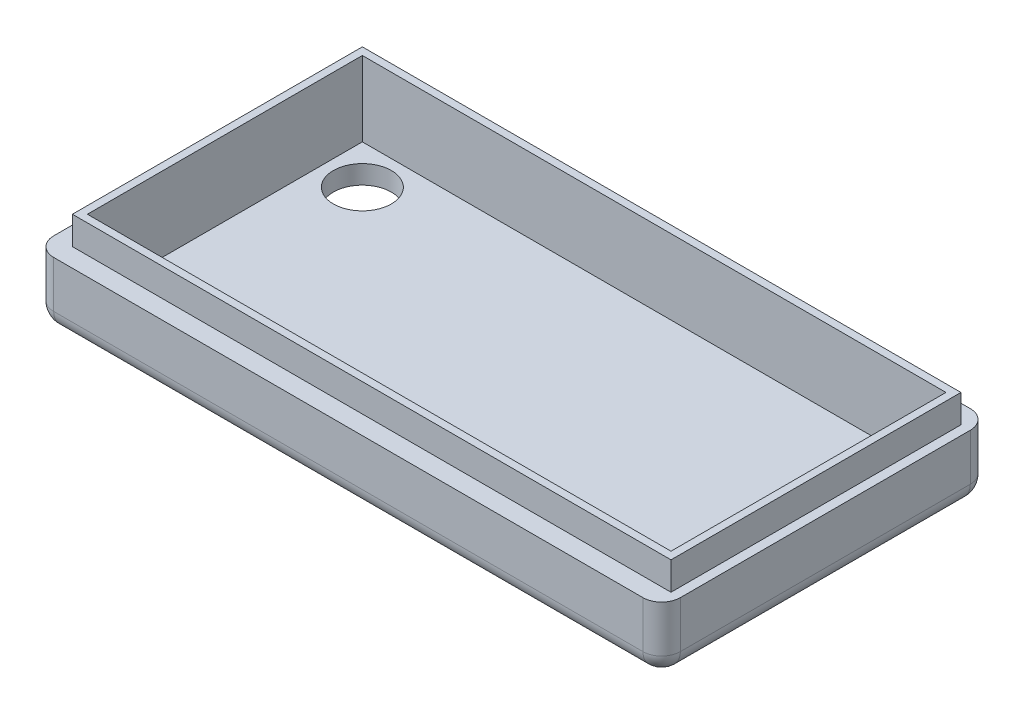
from build123d import *

# Parameters (mm, degrees)
CROQUIS1_W                          = 67
CROQUIS1_H                          = 35
SALIENTE_EXTRUIR1_DEPTH             = 7
CORTAR_EXTRUIR1_DEPTH               = 5
CROQUIS3_R                          = 3.1
CORTAR_EXTRUIR2_DEPTH               = 76.914425507
CROQUIS4_W                          = 64
CROQUIS4_H                          = 31
CROQUIS4_W_2                        = 62.4
CROQUIS4_H_2                        = 29.4
SALIENTE_EXTRUIR2_DEPTH             = 3
SALIENTE_EXTRUIR2_DIRECTION_2_REACH = 77.914
REDONDEO2_R                         = 2
CROQUIS5_W                          = 1.256410257
CROQUIS5_H                          = 7.179487179
CORTAR_EXTRUIR3_DEPTH               = 0.8
CROQUIS6_R                          = 1.75
CORTAR_EXTRUIR5_DEPTH               = 10


with BuildPart() as part:
    # Croquis1 → Saliente-Extruir1 (new body)
    with BuildSketch(Plane(origin=(0, 0, 0), x_dir=(1, 0, 0), z_dir=(0, 1, 0))):
        with Locations((33.5, 17.5)):
            Rectangle(CROQUIS1_W, CROQUIS1_H)
    extrude(amount=SALIENTE_EXTRUIR1_DEPTH)

    # Croquis2 → Cortar-Extruir1 (cut)
    with BuildSketch(Plane(origin=(0, 7, 0), x_dir=(1, 0, 0), z_dir=(0, 1, 0))):
        Polygon((2, 33), (2, 2), (65, 2), (66, 2), (66, 33), (65, 33), align=None)
    extrude(amount=-CORTAR_EXTRUIR1_DEPTH, mode=Mode.SUBTRACT)

    # Croquis3 → Cortar-Extruir2 (cut, through all)
    with BuildSketch(Plane.XZ):
        with Locations((7, -28)):
            Circle(CROQUIS3_R)
    extrude(amount=-CORTAR_EXTRUIR2_DEPTH, mode=Mode.SUBTRACT)

    # Croquis4 → Saliente-Extruir2 (add)
    with BuildSketch(Plane(origin=(0, 7, 0), x_dir=(1, 0, 0), z_dir=(0, 1, 0))):
        with Locations((34, 17.5)):
            Rectangle(CROQUIS4_W, CROQUIS4_H)
        with Locations((34, 17.5)):
            Rectangle(CROQUIS4_W_2, CROQUIS4_H_2, mode=Mode.SUBTRACT)
    extrude(amount=SALIENTE_EXTRUIR2_DEPTH)

    # Croquis4 → Saliente-Extruir2 direction 2 (add, up to next)
    with BuildSketch(Plane(origin=(0, 7, 0), x_dir=(1, 0, 0), z_dir=(0, 1, 0)), mode=Mode.PRIVATE) as saliente_extruir2_direction_2_sk1:
        with Locations((34, 17.5)):
            Rectangle(CROQUIS4_W, CROQUIS4_H)
        with Locations((34, 17.5)):
            Rectangle(CROQUIS4_W_2, CROQUIS4_H_2, mode=Mode.SUBTRACT)
    saliente_extruir2_direction_2_tool1 = extrude(saliente_extruir2_direction_2_sk1.sketch, amount=-SALIENTE_EXTRUIR2_DIRECTION_2_REACH, mode=Mode.PRIVATE) - part.part
    add(saliente_extruir2_direction_2_tool1.solids().sort_by_distance((34, 7, -32.288874))[0])

    # Redondeo2
    redondeo2_edges = [part.edges().sort_by_distance(p)[0] for p in [
        (0, 3.5, 0),
        (0, 3.5, -35),
        (67, 3.5, -35),
        (67, 3.5, 0),
        (33.5, 0, 0),
        (0, 0, -17.5),
        (33.5, 0, -35),
        (67, 0, -17.5),
    ]]
    fillet(redondeo2_edges, radius=REDONDEO2_R)

    # Croquis5 → Cortar-Extruir3 (cut)
    # profile 1 of 7: a face of its own
    with BuildSketch(Plane.XZ):
        with BuildLine():
            Line((11.108974359, -15.615399199), (12.365384615, -15.615399199))
            Line((12.365384615, -15.615399199), (12.365384615, -16.226777404))
            add(Edge.make_bspline(
                [(12.365384615, -16.226777404), (12.421269105, -16.170373894), (12.531301073, -16.059320019), (12.713645567, -15.916550279), (12.903849338, -15.794464512), (13.104217354, -15.695628401), (13.314259524, -15.620159892), (13.532980357, -15.564857681), (13.761503294, -15.532231109), (13.917096528, -15.527871739), (13.99619391, -15.525655609)],
                knots=[0, 0, 0, 0, 1.041528618, 2.050684245, 3.032913108, 4.004406485, 4.976926473, 5.95771665, 6.961784757, 8, 8, 8, 8], degree=3))
            add(Edge.make_bspline(
                [(13.99619391, -15.525655609), (14.075395729, -15.528146859), (14.231301947, -15.533050804), (14.458768035, -15.577926495), (14.67425581, -15.650834329), (14.875394401, -15.754755488), (15.063637519, -15.883092718), (15.230645871, -16.042476324), (15.380973457, -16.226561592), (15.461103848, -16.365732033), (15.502203526, -16.437113942)],
                knots=[0, 0, 0, 0, 1.023965777, 2.015643508, 2.987309376, 3.958410333, 4.93654923, 5.924956801, 6.93568961, 8, 8, 8, 8], degree=3))
            add(Edge.make_bspline(
                [(15.502203526, -16.437113942), (15.555145222, -16.365537846), (15.659054915, -16.225054056), (15.84324431, -16.04163654), (16.042407999, -15.883076099), (16.260399342, -15.753808013), (16.491429243, -15.651189047), (16.734486745, -15.578197387), (16.987368206, -15.533125803), (17.159467918, -15.52816636), (17.246594551, -15.525655609)],
                knots=[0, 0, 0, 0, 1.041189987, 2.043563759, 3.033412161, 4.015238574, 5.00275396, 5.986226558, 6.980513695, 8, 8, 8, 8], degree=3))
            add(Edge.make_bspline(
                [(17.246594551, -15.525655609), (17.336586017, -15.528262637), (17.51183603, -15.533339582), (17.765798465, -15.583287831), (18.003665018, -15.660465371), (18.220178903, -15.772777581), (18.415957641, -15.905815841), (18.582784742, -16.063006097), (18.721235993, -16.238863309), (18.811385512, -16.403071036), (18.869664754, -16.548249471), (18.904854278, -16.674581912), (18.937767371, -16.81564806), (18.961412134, -16.973344043), (18.983483478, -17.146187641), (18.99629676, -17.335327976), (19.005006081, -17.540127879), (19.005931121, -17.681827816), (19.006410256, -17.755222917)],
                knots=[0, 0, 0, 0, 1.321991808, 2.574456155, 3.791773975, 4.987670122, 6.148905103, 7.262530793, 8.344737981, 9.427709016, 10.004683293, 10.642050061, 11.354108788, 12.133887687, 12.985666279, 13.916212488, 14.92067847, 16, 16, 16, 16], degree=3))
            Line((19.006410256, -17.755222917), (19.006410256, -20.730783814))
            Line((19.006410256, -20.730783814), (17.75, -20.730783814))
            Line((17.75, -20.730783814), (17.75, -18.161873558))
            add(Edge.make_bspline(
                [(17.75, -18.161873558), (17.748954276, -18.093159984), (17.746947105, -17.961270487), (17.738413844, -17.772100185), (17.719312755, -17.600539045), (17.696923832, -17.445636779), (17.664884851, -17.308214698), (17.625819131, -17.187941527), (17.580503134, -17.084644139), (17.525785433, -16.998333298), (17.464501543, -16.925645937), (17.396332057, -16.863338473), (17.321987744, -16.810177877), (17.240794566, -16.764866024), (17.150625468, -16.734220721), (17.054524418, -16.710175322), (16.951739395, -16.693800234), (16.880673853, -16.692823999), (16.844150641, -16.692322276)],
                knots=[0, 0, 0, 0, 1.669139205, 3.203761885, 4.596586177, 5.860166715, 7.002923539, 8.018877315, 8.928339525, 9.734594377, 10.491888885, 11.231098709, 11.971440889, 12.708030942, 13.480072485, 14.275788656, 15.113863979, 16, 16, 16, 16], degree=3))
            add(Edge.make_bspline(
                [(16.844150641, -16.692322276), (16.787868889, -16.694268082), (16.677427149, -16.698086339), (16.516491025, -16.734574062), (16.365048947, -16.794227584), (16.223668278, -16.875380917), (16.095391217, -16.976739897), (15.983181261, -17.096961311), (15.890511486, -17.236738007), (15.826363209, -17.366422742), (15.786278593, -17.483683802), (15.75800254, -17.584108483), (15.735962481, -17.697673942), (15.718711567, -17.823230025), (15.70216133, -17.961486513), (15.694041877, -18.112268575), (15.685733198, -18.275366739), (15.68584136, -18.388088553), (15.685897436, -18.446529006)],
                knots=[0, 0, 0, 0, 1.129913425, 2.217230253, 3.297175357, 4.391411011, 5.481605898, 6.571841268, 7.681894157, 8.841607612, 9.468549532, 10.170608623, 10.93710061, 11.791434153, 12.717934886, 13.734733707, 14.825576123, 16, 16, 16, 16], degree=3))
            Line((15.685897436, -18.446529006), (15.685897436, -20.730783814))
            Line((15.685897436, -20.730783814), (14.429487179, -20.730783814))
            Line((14.429487179, -20.730783814), (14.429487179, -18.278259776))
            add(Edge.make_bspline(
                [(14.429487179, -18.278259776), (14.429381691, -18.22356526), (14.429178765, -18.11835073), (14.42307922, -17.966418934), (14.41500223, -17.826130756), (14.403679231, -17.697094907), (14.390620381, -17.579471876), (14.371773452, -17.473905143), (14.351973013, -17.379813003), (14.318024894, -17.27292714), (14.270187629, -17.154479715), (14.198718055, -17.028872817), (14.112301579, -16.923706641), (14.013122372, -16.838162772), (13.901045613, -16.772985207), (13.778910554, -16.7245012), (13.644385103, -16.698331021), (13.551786776, -16.694367458), (13.50400641, -16.692322276)],
                knots=[0, 0, 0, 0, 1.256487322, 2.417074606, 3.49288742, 4.484586665, 5.393016842, 6.210437544, 6.947749329, 7.599905853, 8.784490193, 9.876739139, 10.906602197, 11.896672079, 12.869113195, 13.872201355, 14.902064413, 16, 16, 16, 16], degree=3))
            add(Edge.make_bspline(
                [(13.50400641, -16.692322276), (13.450018708, -16.694154712), (13.343095613, -16.697783867), (13.18734579, -16.736763961), (13.038434515, -16.795322952), (12.899637684, -16.878739774), (12.773293125, -16.98248404), (12.66220663, -17.106125051), (12.57002387, -17.24951615), (12.50559085, -17.382778055), (12.466090716, -17.502964616), (12.437054361, -17.605996918), (12.415834332, -17.722063345), (12.398129495, -17.849860676), (12.381677242, -17.989539762), (12.373524192, -18.141714857), (12.365223724, -18.306217288), (12.365329692, -18.419873007), (12.365384615, -18.478780609)],
                knots=[0, 0, 0, 0, 1.07893236, 2.136834559, 3.195274846, 4.273923004, 5.364443877, 6.458052972, 7.587287137, 8.767908, 9.410170275, 10.118584836, 10.909717261, 11.770069756, 12.702352573, 13.724628867, 14.820678298, 16, 16, 16, 16], degree=3))
            Line((12.365384615, -18.478780609), (12.365384615, -20.730783814))
            Line((12.365384615, -20.730783814), (11.108974359, -20.730783814))
            Line((11.108974359, -20.730783814), (11.108974359, -15.615399199))
        make_face()
    # profile 2 of 7: a face of its own
    with BuildSketch(Plane.XZ):
        with BuildLine():
            Line((26.724358974, -14.945126763), (25.803084936, -15.825735737))
            add(Edge.make_bspline(
                [(25.803084936, -15.825735737), (25.724934967, -15.744928538), (25.572283593, -15.587086762), (25.326304783, -15.37811816), (25.070495777, -15.203971105), (24.809832828, -15.057305564), (24.539627366, -14.946342629), (24.263003701, -14.865482069), (23.978195511, -14.816184443), (23.785448282, -14.810543922), (23.688501603, -14.807706891)],
                knots=[0, 0, 0, 0, 1.115251505, 2.178435587, 3.19620269, 4.182487026, 5.141301733, 6.088180966, 7.038406374, 8, 8, 8, 8], degree=3))
            add(Edge.make_bspline(
                [(23.688501603, -14.807706891), (23.607539344, -14.809948244), (23.447769247, -14.814371308), (23.213184877, -14.846796728), (22.988792804, -14.901937567), (22.773824898, -14.977931856), (22.56891371, -15.076264434), (22.37362962, -15.196859192), (22.188454093, -15.338626988), (22.015833189, -15.50083431), (21.857925653, -15.678057999), (21.71840429, -15.867155252), (21.601532768, -16.067692859), (21.505618211, -16.277639921), (21.430904478, -16.497968178), (21.377549487, -16.728529295), (21.346690385, -16.969597854), (21.342084458, -17.133474464), (21.33974359, -17.216761378)],
                knots=[0, 0, 0, 0, 1.035432265, 2.043311493, 3.022114605, 3.98653278, 4.95457646, 5.923598177, 6.917315552, 7.932509744, 8.948865224, 9.949768934, 10.933144597, 11.912367597, 12.897413939, 13.903909035, 14.934704909, 16, 16, 16, 16], degree=3))
            add(Edge.make_bspline(
                [(21.33974359, -17.216761378), (21.340418201, -17.275217962), (21.341747874, -17.39043709), (21.356303497, -17.560878157), (21.379741482, -17.726246287), (21.413662052, -17.88629099), (21.456080059, -18.041150963), (21.50584604, -18.192162175), (21.568276731, -18.33723799), (21.63757574, -18.478063371), (21.718169689, -18.610795721), (21.805064833, -18.737367031), (21.89928843, -18.857156864), (22.001450771, -18.969675514), (22.112989665, -19.073164566), (22.231022243, -19.17073606), (22.357539552, -19.25994745), (22.489913507, -19.343037595), (22.629287651, -19.415218711), (22.77188044, -19.480600857), (22.91985387, -19.53370088), (23.071406274, -19.576504344), (23.225996057, -19.612902296), (23.385135251, -19.635313635), (23.547444319, -19.652285479), (23.657138006, -19.653333391), (23.712339744, -19.653860737)],
                knots=[0, 0, 0, 0, 1.103660481, 2.175337485, 3.227646561, 4.255952547, 5.262355991, 6.258840057, 7.255597736, 8.242457506, 9.22035537, 10.185017736, 11.140346927, 12.096287581, 13.051739095, 14.01125915, 14.986044842, 15.97314143, 16.960198552, 17.947847494, 18.933482797, 19.925264591, 20.920966487, 21.929612487, 22.958107872, 24, 24, 24, 24], degree=3))
            add(Edge.make_bspline(
                [(23.712339744, -19.653860737), (23.805971377, -19.651152413), (23.98993319, -19.645831262), (24.259923602, -19.604220608), (24.517197566, -19.535773436), (24.722758232, -19.454941304), (24.883809585, -19.375118525), (25.006415599, -19.301286384), (25.133199773, -19.218697029), (25.262056331, -19.124233447), (25.394434653, -19.019029239), (25.527997957, -18.900780237), (25.666165487, -18.773380211), (25.756677666, -18.68245231), (25.803084936, -18.635831891)],
                knots=[0, 0, 0, 0, 1.404581149, 2.759636711, 4.088442092, 5.392261763, 6.066678138, 6.783632037, 7.538459478, 8.336747902, 9.180226004, 10.074962426, 11.012997595, 12, 12, 12, 12], degree=3))
            Line((25.803084936, -18.635831891), (26.696314103, -19.573932853))
            add(Edge.make_bspline(
                [(26.696314103, -19.573932853), (26.6335249, -19.634553856), (26.510973805, -19.752873092), (26.326108879, -19.920875365), (26.141476614, -20.071844083), (25.961537339, -20.21125875), (25.783343462, -20.335057877), (25.60691388, -20.443365104), (25.434245852, -20.538919678), (25.261753873, -20.620110117), (25.088364607, -20.689049232), (24.909967429, -20.748401285), (24.726016961, -20.798610986), (24.535389719, -20.839123622), (24.339863755, -20.871609286), (24.137609208, -20.893536921), (23.929908471, -20.908278141), (23.789021844, -20.909602762), (23.717948718, -20.910270994)],
                knots=[0, 0, 0, 0, 1.244526981, 2.429050516, 3.560637417, 4.644440555, 5.67424972, 6.652764056, 7.595344123, 8.486817594, 9.369275933, 10.254498637, 11.166417451, 12.086725134, 13.032340136, 13.991389299, 14.986715468, 16, 16, 16, 16], degree=3))
            add(Edge.make_bspline(
                [(23.717948718, -20.910270994), (23.58739619, -20.906942949), (23.331941182, -20.900430892), (22.957578529, -20.852180954), (22.601944057, -20.771290783), (22.264172576, -20.656889771), (21.944371487, -20.510747839), (21.642622607, -20.331584692), (21.359412286, -20.11987634), (21.097028308, -19.878104208), (20.859689513, -19.611087186), (20.649909502, -19.324384157), (20.47637947, -19.016586082), (20.332293745, -18.692240122), (20.219620603, -18.349866159), (20.140317813, -17.989093849), (20.09141236, -17.610271541), (20.086062034, -17.351527172), (20.083333333, -17.219565865)],
                knots=[0, 0, 0, 0, 1.078019885, 2.10938526, 3.111377082, 4.085535484, 5.04941344, 6.010039228, 6.978205633, 7.964457913, 8.951525778, 9.924444315, 10.892603023, 11.863865945, 12.85144698, 13.863884204, 14.910567087, 16, 16, 16, 16], degree=3))
            add(Edge.make_bspline(
                [(20.083333333, -17.219565865), (20.08448635, -17.133501827), (20.086771348, -16.962943938), (20.110786882, -16.711698349), (20.144265934, -16.46677884), (20.197377406, -16.230728489), (20.261398046, -16.00036726), (20.341016124, -15.778198912), (20.436104478, -15.563584911), (20.543598187, -15.35616598), (20.665204745, -15.157300934), (20.801052619, -14.968698339), (20.947644557, -14.788902217), (21.108502923, -14.620297897), (21.281290235, -14.461405), (21.466786608, -14.313084598), (21.663876373, -14.173209608), (21.873092979, -14.045387068), (22.090371906, -13.929764786), (22.312972693, -13.827780995), (22.540348438, -13.742546031), (22.771537774, -13.671846773), (23.007517473, -13.619074776), (23.246603173, -13.579128076), (23.490829206, -13.556797616), (23.654805829, -13.553141977), (23.737580128, -13.551296635)],
                knots=[0, 0, 0, 0, 1.071919942, 2.124283339, 3.142214191, 4.149696895, 5.136002878, 6.119640489, 7.086990633, 8.058538607, 9.028339693, 9.988281803, 10.952401235, 11.916291999, 12.888973767, 13.874849856, 14.873389453, 15.898127285, 16.927174885, 17.938320013, 18.946391617, 19.950418109, 20.947802303, 21.956882652, 22.968648068, 24, 24, 24, 24], degree=3))
            add(Edge.make_bspline(
                [(23.737580128, -13.551296635), (23.808195093, -13.552354431), (23.948690823, -13.554459025), (24.157912541, -13.572003106), (24.365461001, -13.599555907), (24.570593117, -13.641127218), (24.774776203, -13.690477616), (24.975327065, -13.755095156), (25.1754095, -13.827123581), (25.371885514, -13.913218855), (25.565029357, -14.007199625), (25.750316331, -14.113824221), (25.930857387, -14.226531084), (26.102651844, -14.351990702), (26.268917781, -14.48565242), (26.42878578, -14.628139845), (26.580852906, -14.781828661), (26.676281791, -14.890418883), (26.724358974, -14.945126763)],
                knots=[0, 0, 0, 0, 0.996412454, 1.982464992, 2.961075852, 3.949442424, 4.934965278, 5.923860011, 6.921385422, 7.934793307, 8.949617135, 9.951082467, 10.950285876, 11.951772932, 12.951063433, 13.960125323, 14.972308753, 16, 16, 16, 16], degree=3))
        make_face()
    # profile 3 of 7: a face of its own
    with BuildSketch(Plane.XZ):
        with BuildLine():
            Line((31.66025641, -15.615399199), (32.916666667, -15.615399199))
            Line((32.916666667, -15.615399199), (32.916666667, -20.730783814))
            Line((32.916666667, -20.730783814), (31.66025641, -20.730783814))
            Line((31.66025641, -20.730783814), (31.66025641, -20.172690865))
            add(Edge.make_bspline(
                [(31.66025641, -20.172690865), (31.598001745, -20.227015037), (31.477177734, -20.332447527), (31.286798188, -20.469248862), (31.095862332, -20.582092284), (30.903452712, -20.671965915), (30.706612075, -20.738328342), (30.503923245, -20.786376289), (30.292467289, -20.814711338), (30.148722443, -20.818568521), (30.075721154, -20.820527404)],
                knots=[0, 0, 0, 0, 1.129196829, 2.191548051, 3.199897424, 4.157751732, 5.089409408, 6.034969131, 7.002052659, 8, 8, 8, 8], degree=3))
            add(Edge.make_bspline(
                [(30.075721154, -20.820527404), (29.993773962, -20.818683848), (29.831841665, -20.815040878), (29.594223998, -20.776692739), (29.364780517, -20.717992365), (29.143697467, -20.634923999), (28.931377087, -20.527283681), (28.726194484, -20.397879899), (28.531667113, -20.242169804), (28.346175599, -20.066890577), (28.176340681, -19.87408218), (28.027869393, -19.666420767), (27.902719132, -19.446851557), (27.800190219, -19.216102524), (27.719537989, -18.974343022), (27.66204449, -18.720806266), (27.628123259, -18.455401705), (27.623924767, -18.274618512), (27.621794872, -18.182907212)],
                knots=[0, 0, 0, 0, 0.980476535, 1.937477201, 2.874147792, 3.812856188, 4.758993464, 5.720109578, 6.712210464, 7.737600662, 8.772720504, 9.783789959, 10.789002326, 11.793715968, 12.802552247, 13.835794126, 14.902098527, 16, 16, 16, 16], degree=3))
            add(Edge.make_bspline(
                [(27.621794872, -18.182907212), (27.624030205, -18.08794004), (27.628415059, -17.901651351), (27.660490005, -17.628281557), (27.716922533, -17.368458378), (27.793872341, -17.121821921), (27.892854907, -16.888329577), (28.01340906, -16.66759881), (28.157174824, -16.460206575), (28.322839382, -16.269682834), (28.501716414, -16.095058623), (28.693083217, -15.9430344), (28.893947231, -15.813882748), (29.104521909, -15.70844488), (29.324777181, -15.626967832), (29.553843482, -15.567401457), (29.792737705, -15.53165954), (29.955474385, -15.52767354), (30.037860577, -15.525655609)],
                knots=[0, 0, 0, 0, 1.136281865, 2.228943489, 3.287578264, 4.313574083, 5.316051562, 6.317280042, 7.318008486, 8.329309503, 9.333984563, 10.305318864, 11.248632312, 12.186624717, 13.117503092, 14.05354244, 15.014596925, 16, 16, 16, 16], degree=3))
            add(Edge.make_bspline(
                [(30.037860577, -15.525655609), (30.114176885, -15.527241096), (30.265179351, -15.530378204), (30.487131219, -15.564441191), (30.702392519, -15.615959041), (30.909788989, -15.689362703), (31.111021765, -15.78204976), (31.302629516, -15.898193551), (31.488803835, -16.032912605), (31.602399441, -16.138131039), (31.66025641, -16.191721314)],
                knots=[0, 0, 0, 0, 1.017011718, 2.012299608, 2.98747302, 3.965332399, 4.941441765, 5.936729654, 6.94912688, 8, 8, 8, 8], degree=3))
            Line((31.66025641, -16.191721314), (31.66025641, -15.615399199))
        make_face()
        with BuildLine():
            add(Edge.make_bspline(
                [(30.301482372, -16.692322276), (30.251418127, -16.693858419), (30.153295475, -16.696869161), (30.008992688, -16.714978982), (29.871082513, -16.746889294), (29.740548514, -16.794029927), (29.615445255, -16.851454086), (29.497672448, -16.923376901), (29.386258079, -17.008388139), (29.281857388, -17.10442968), (29.186680776, -17.209996894), (29.104632981, -17.325193597), (29.034905611, -17.446915892), (28.975934378, -17.575529757), (28.933724354, -17.712557091), (28.900294033, -17.856214042), (28.882945861, -18.007674213), (28.879801184, -18.110889633), (28.878205128, -18.163275801)],
                knots=[0, 0, 0, 0, 1.04836806, 2.054732945, 3.03993516, 4.00574415, 4.955904794, 5.917688631, 6.888591924, 7.88601754, 8.884115178, 9.859153345, 10.841239365, 11.818093293, 12.814750328, 13.83810466, 14.90274714, 16, 16, 16, 16], degree=3))
            add(Edge.make_bspline(
                [(28.878205128, -18.163275801), (28.879776804, -18.216137143), (28.882873772, -18.320299803), (28.900574536, -18.473037596), (28.932801896, -18.618793037), (28.9798204, -18.756387794), (29.037240899, -18.887678475), (29.107134559, -19.012059161), (29.192986679, -19.127330646), (29.288246724, -19.236220639), (29.394789179, -19.333455178), (29.506833975, -19.419790521), (29.625911556, -19.492027248), (29.750730014, -19.550409427), (29.880869204, -19.597985995), (30.017960678, -19.62949526), (30.160661452, -19.649638536), (30.257944337, -19.652443618), (30.307091346, -19.653860737)],
                knots=[0, 0, 0, 0, 1.099136573, 2.165835871, 3.191374663, 4.196217796, 5.183857741, 6.167377911, 7.154730987, 8.166690795, 9.170734848, 10.148332609, 11.103258353, 12.059567475, 13.009337315, 13.978056681, 14.978520572, 16, 16, 16, 16], degree=3))
            add(Edge.make_bspline(
                [(30.307091346, -19.653860737), (30.358088096, -19.652315981), (30.458069449, -19.64928742), (30.604726463, -19.631342871), (30.744489267, -19.599315557), (30.876776372, -19.551905033), (31.003608338, -19.494893066), (31.123840621, -19.424375678), (31.236168519, -19.339559517), (31.34116092, -19.242649758), (31.437366217, -19.136220524), (31.520548668, -19.0195132), (31.593003626, -18.896260405), (31.649986117, -18.763547994), (31.695238205, -18.623697814), (31.727705535, -18.475841927), (31.74536588, -18.319820925), (31.748435763, -18.213330511), (31.75, -18.159069071)],
                knots=[0, 0, 0, 0, 1.050008698, 2.058587853, 3.036635738, 3.995319155, 4.947022481, 5.895997462, 6.858296291, 7.838991643, 8.833936038, 9.806048392, 10.784806122, 11.771666913, 12.772873988, 13.80724452, 14.882696879, 16, 16, 16, 16], degree=3))
            add(Edge.make_bspline(
                [(31.75, -18.159069071), (31.7484552, -18.105740901), (31.745437757, -18.001575494), (31.727629371, -17.848812137), (31.694931541, -17.703859464), (31.650610815, -17.566451034), (31.592614589, -17.436901028), (31.520104809, -17.316645849), (31.437834822, -17.201519104), (31.340564394, -17.097965114), (31.23614076, -17.001757055), (31.122160898, -16.919505797), (31.002215794, -16.84861938), (30.875568502, -16.790418898), (30.741046325, -16.747755738), (30.601044676, -16.714723214), (30.453379239, -16.69688003), (30.352940922, -16.69386632), (30.301482372, -16.692322276)],
                knots=[0, 0, 0, 0, 1.106611376, 2.161533483, 3.185006901, 4.184773755, 5.152708835, 6.122342771, 7.094156588, 8.082475533, 9.064254463, 10.03606828, 10.992420271, 11.951521816, 12.920622147, 13.915721683, 14.932141191, 16, 16, 16, 16], degree=3))
        make_face(mode=Mode.SUBTRACT)
    # profile 4 of 7: a face of its own
    with BuildSketch(Plane.XZ):
        with Locations((34.711538461, -17.141040225)):
            Rectangle(CROQUIS5_W, CROQUIS5_H)
    # profile 5 of 7: a face of its own
    with BuildSketch(Plane.XZ):
        with BuildLine():
            Line((42.967948718, -14.945126763), (42.046674679, -15.825735737))
            add(Edge.make_bspline(
                [(42.046674679, -15.825735737), (41.96852471, -15.744928538), (41.815873336, -15.587086762), (41.569894526, -15.37811816), (41.31408552, -15.203971105), (41.053422572, -15.057305564), (40.783217109, -14.946342629), (40.506593445, -14.865482069), (40.221785254, -14.816184443), (40.029038025, -14.810543922), (39.932091346, -14.807706891)],
                knots=[0, 0, 0, 0, 1.115251505, 2.178435587, 3.19620269, 4.182487026, 5.141301733, 6.088180966, 7.038406374, 8, 8, 8, 8], degree=3))
            add(Edge.make_bspline(
                [(39.932091346, -14.807706891), (39.851129088, -14.809948244), (39.691358991, -14.814371308), (39.456774621, -14.846796728), (39.232382548, -14.901937567), (39.017414641, -14.977931856), (38.812503454, -15.076264434), (38.617219364, -15.196859192), (38.432043836, -15.338626988), (38.259422932, -15.50083431), (38.101515396, -15.678057999), (37.961994033, -15.867155252), (37.845122511, -16.067692859), (37.749207954, -16.277639921), (37.674494222, -16.497968178), (37.62113923, -16.728529295), (37.590280129, -16.969597854), (37.585674201, -17.133474464), (37.583333333, -17.216761378)],
                knots=[0, 0, 0, 0, 1.035432265, 2.043311493, 3.022114605, 3.98653278, 4.95457646, 5.923598177, 6.917315552, 7.932509744, 8.948865224, 9.949768934, 10.933144597, 11.912367597, 12.897413939, 13.903909035, 14.934704909, 16, 16, 16, 16], degree=3))
            add(Edge.make_bspline(
                [(37.583333333, -17.216761378), (37.584007945, -17.275217962), (37.585337618, -17.39043709), (37.59989324, -17.560878157), (37.623331225, -17.726246287), (37.657251796, -17.88629099), (37.699669803, -18.041150963), (37.749435784, -18.192162175), (37.811866475, -18.33723799), (37.881165484, -18.478063371), (37.961759432, -18.610795721), (38.048654577, -18.737367031), (38.142878174, -18.857156864), (38.245040515, -18.969675514), (38.356579409, -19.073164566), (38.474611987, -19.17073606), (38.601129296, -19.25994745), (38.73350325, -19.343037595), (38.872877394, -19.415218711), (39.015470184, -19.480600857), (39.163443613, -19.53370088), (39.314996017, -19.576504344), (39.4695858, -19.612902296), (39.628724995, -19.635313635), (39.791034063, -19.652285479), (39.900727749, -19.653333391), (39.955929487, -19.653860737)],
                knots=[0, 0, 0, 0, 1.103660481, 2.175337485, 3.227646561, 4.255952547, 5.262355991, 6.258840057, 7.255597736, 8.242457506, 9.22035537, 10.185017736, 11.140346927, 12.096287581, 13.051739095, 14.01125915, 14.986044842, 15.97314143, 16.960198552, 17.947847494, 18.933482797, 19.925264591, 20.920966487, 21.929612487, 22.958107872, 24, 24, 24, 24], degree=3))
            add(Edge.make_bspline(
                [(39.955929487, -19.653860737), (40.049561121, -19.651152413), (40.233522934, -19.645831262), (40.503513345, -19.604220608), (40.76078731, -19.535773436), (40.966347976, -19.454941304), (41.127399329, -19.375118525), (41.250005342, -19.301286384), (41.376789517, -19.218697029), (41.505646075, -19.124233447), (41.638024397, -19.019029239), (41.7715877, -18.900780237), (41.90975523, -18.773380211), (42.000267409, -18.68245231), (42.046674679, -18.635831891)],
                knots=[0, 0, 0, 0, 1.404581149, 2.759636711, 4.088442092, 5.392261763, 6.066678138, 6.783632037, 7.538459478, 8.336747902, 9.180226004, 10.074962426, 11.012997595, 12, 12, 12, 12], degree=3))
            Line((42.046674679, -18.635831891), (42.939903846, -19.573932853))
            add(Edge.make_bspline(
                [(42.939903846, -19.573932853), (42.877114644, -19.634553856), (42.754563548, -19.752873092), (42.569698623, -19.920875365), (42.385066357, -20.071844083), (42.205127082, -20.21125875), (42.026933205, -20.335057877), (41.850503623, -20.443365104), (41.677835596, -20.538919678), (41.505343617, -20.620110117), (41.331954351, -20.689049232), (41.153557173, -20.748401285), (40.969606705, -20.798610986), (40.778979462, -20.839123622), (40.583453499, -20.871609286), (40.381198952, -20.893536921), (40.173498215, -20.908278141), (40.032611587, -20.909602762), (39.961538462, -20.910270994)],
                knots=[0, 0, 0, 0, 1.244526981, 2.429050516, 3.560637417, 4.644440555, 5.67424972, 6.652764056, 7.595344123, 8.486817594, 9.369275933, 10.254498637, 11.166417451, 12.086725134, 13.032340136, 13.991389299, 14.986715468, 16, 16, 16, 16], degree=3))
            add(Edge.make_bspline(
                [(39.961538462, -20.910270994), (39.830985934, -20.906942949), (39.575530926, -20.900430892), (39.201168273, -20.852180954), (38.845533801, -20.771290783), (38.507762319, -20.656889771), (38.187961231, -20.510747839), (37.88621235, -20.331584692), (37.60300203, -20.11987634), (37.340618052, -19.878104208), (37.103279256, -19.611087186), (36.893499246, -19.324384157), (36.719969214, -19.016586082), (36.575883489, -18.692240122), (36.463210347, -18.349866159), (36.383907556, -17.989093849), (36.335002104, -17.610271541), (36.329651778, -17.351527172), (36.326923077, -17.219565865)],
                knots=[0, 0, 0, 0, 1.078019885, 2.10938526, 3.111377082, 4.085535484, 5.04941344, 6.010039228, 6.978205633, 7.964457913, 8.951525778, 9.924444315, 10.892603023, 11.863865945, 12.85144698, 13.863884204, 14.910567087, 16, 16, 16, 16], degree=3))
            add(Edge.make_bspline(
                [(36.326923077, -17.219565865), (36.328076094, -17.133501827), (36.330361091, -16.962943938), (36.354376626, -16.711698349), (36.387855678, -16.46677884), (36.440967149, -16.230728489), (36.50498779, -16.00036726), (36.584605868, -15.778198912), (36.679694222, -15.563584911), (36.787187931, -15.35616598), (36.908794488, -15.157300934), (37.044642363, -14.968698339), (37.1912343, -14.788902217), (37.352092667, -14.620297897), (37.524879979, -14.461405), (37.710376351, -14.313084598), (37.907466116, -14.173209608), (38.116682723, -14.045387068), (38.333961649, -13.929764786), (38.556562437, -13.827780995), (38.783938182, -13.742546031), (39.015127517, -13.671846773), (39.251107217, -13.619074776), (39.490192917, -13.579128076), (39.73441895, -13.556797616), (39.898395573, -13.553141977), (39.981169872, -13.551296635)],
                knots=[0, 0, 0, 0, 1.071919942, 2.124283339, 3.142214191, 4.149696895, 5.136002878, 6.119640489, 7.086990633, 8.058538607, 9.028339693, 9.988281803, 10.952401235, 11.916291999, 12.888973767, 13.874849856, 14.873389453, 15.898127285, 16.927174885, 17.938320013, 18.946391617, 19.950418109, 20.947802303, 21.956882652, 22.968648068, 24, 24, 24, 24], degree=3))
            add(Edge.make_bspline(
                [(39.981169872, -13.551296635), (40.051784836, -13.552354431), (40.192280566, -13.554459025), (40.401502284, -13.572003106), (40.609050745, -13.599555907), (40.814182861, -13.641127218), (41.018365947, -13.690477616), (41.218916809, -13.755095156), (41.418999244, -13.827123581), (41.615475257, -13.913218855), (41.808619101, -14.007199625), (41.993906075, -14.113824221), (42.174447131, -14.226531084), (42.346241587, -14.351990702), (42.512507525, -14.48565242), (42.672375524, -14.628139845), (42.82444265, -14.781828661), (42.919871534, -14.890418883), (42.967948718, -14.945126763)],
                knots=[0, 0, 0, 0, 0.996412454, 1.982464992, 2.961075852, 3.949442424, 4.934965278, 5.923860011, 6.921385422, 7.934793307, 8.949617135, 9.951082467, 10.950285876, 11.951772932, 12.951063433, 13.960125323, 14.972308753, 16, 16, 16, 16], degree=3))
        make_face()
    # profile 6 of 7: a face of its own
    with BuildSketch(Plane.XZ):
        with BuildLine():
            Line((47.903846154, -15.615399199), (49.16025641, -15.615399199))
            Line((49.16025641, -15.615399199), (49.16025641, -20.730783814))
            Line((49.16025641, -20.730783814), (47.903846154, -20.730783814))
            Line((47.903846154, -20.730783814), (47.903846154, -20.172690865))
            add(Edge.make_bspline(
                [(47.903846154, -20.172690865), (47.841591489, -20.227015037), (47.720767477, -20.332447527), (47.530387932, -20.469248862), (47.339452076, -20.582092284), (47.147042456, -20.671965915), (46.950201818, -20.738328342), (46.747512989, -20.786376289), (46.536057032, -20.814711338), (46.392312187, -20.818568521), (46.319310897, -20.820527404)],
                knots=[0, 0, 0, 0, 1.129196829, 2.191548051, 3.199897424, 4.157751732, 5.089409408, 6.034969131, 7.002052659, 8, 8, 8, 8], degree=3))
            add(Edge.make_bspline(
                [(46.319310897, -20.820527404), (46.237363705, -20.818683848), (46.075431409, -20.815040878), (45.837813742, -20.776692739), (45.60837026, -20.717992365), (45.38728721, -20.634923999), (45.174966831, -20.527283681), (44.969784228, -20.397879899), (44.775256856, -20.242169804), (44.589765342, -20.066890577), (44.419930425, -19.87408218), (44.271459137, -19.666420767), (44.146308875, -19.446851557), (44.043779963, -19.216102524), (43.963127733, -18.974343022), (43.905634234, -18.720806266), (43.871713003, -18.455401705), (43.86751451, -18.274618512), (43.865384615, -18.182907212)],
                knots=[0, 0, 0, 0, 0.980476535, 1.937477201, 2.874147792, 3.812856188, 4.758993464, 5.720109578, 6.712210464, 7.737600662, 8.772720504, 9.783789959, 10.789002326, 11.793715968, 12.802552247, 13.835794126, 14.902098527, 16, 16, 16, 16], degree=3))
            add(Edge.make_bspline(
                [(43.865384615, -18.182907212), (43.867619948, -18.08794004), (43.872004802, -17.901651351), (43.904079749, -17.628281557), (43.960512276, -17.368458378), (44.037462085, -17.121821921), (44.136444651, -16.888329577), (44.256998803, -16.66759881), (44.400764568, -16.460206575), (44.566429125, -16.269682834), (44.745306158, -16.095058623), (44.936672961, -15.9430344), (45.137536974, -15.813882748), (45.348111653, -15.70844488), (45.568366925, -15.626967832), (45.797433226, -15.567401457), (46.036327448, -15.53165954), (46.199064129, -15.52767354), (46.281450321, -15.525655609)],
                knots=[0, 0, 0, 0, 1.136281865, 2.228943489, 3.287578264, 4.313574083, 5.316051562, 6.317280042, 7.318008486, 8.329309503, 9.333984563, 10.305318864, 11.248632312, 12.186624717, 13.117503092, 14.05354244, 15.014596925, 16, 16, 16, 16], degree=3))
            add(Edge.make_bspline(
                [(46.281450321, -15.525655609), (46.357766629, -15.527241096), (46.508769094, -15.530378204), (46.730720962, -15.564441191), (46.945982262, -15.615959041), (47.153378733, -15.689362703), (47.354611509, -15.78204976), (47.54621926, -15.898193551), (47.732393578, -16.032912605), (47.845989184, -16.138131039), (47.903846154, -16.191721314)],
                knots=[0, 0, 0, 0, 1.017011718, 2.012299608, 2.98747302, 3.965332399, 4.941441765, 5.936729654, 6.94912688, 8, 8, 8, 8], degree=3))
            Line((47.903846154, -16.191721314), (47.903846154, -15.615399199))
        make_face()
        with BuildLine():
            add(Edge.make_bspline(
                [(46.545072115, -16.692322276), (46.49500787, -16.693858419), (46.396885219, -16.696869161), (46.252582432, -16.714978982), (46.114672256, -16.746889294), (45.984138257, -16.794029927), (45.859034998, -16.851454086), (45.741262191, -16.923376901), (45.629847823, -17.008388139), (45.525447132, -17.10442968), (45.43027052, -17.209996894), (45.348222725, -17.325193597), (45.278495355, -17.446915892), (45.219524121, -17.575529757), (45.177314098, -17.712557091), (45.143883777, -17.856214042), (45.126535604, -18.007674213), (45.123390928, -18.110889633), (45.121794872, -18.163275801)],
                knots=[0, 0, 0, 0, 1.04836806, 2.054732945, 3.03993516, 4.00574415, 4.955904794, 5.917688631, 6.888591924, 7.88601754, 8.884115178, 9.859153345, 10.841239365, 11.818093293, 12.814750328, 13.83810466, 14.90274714, 16, 16, 16, 16], degree=3))
            add(Edge.make_bspline(
                [(45.121794872, -18.163275801), (45.123366547, -18.216137143), (45.126463516, -18.320299803), (45.14416428, -18.473037596), (45.17639164, -18.618793037), (45.223410143, -18.756387794), (45.280830642, -18.887678475), (45.350724303, -19.012059161), (45.436576423, -19.127330646), (45.531836468, -19.236220639), (45.638378922, -19.333455178), (45.750423718, -19.419790521), (45.869501299, -19.492027248), (45.994319757, -19.550409427), (46.124458948, -19.597985995), (46.261550422, -19.62949526), (46.404251195, -19.649638536), (46.501534081, -19.652443618), (46.55068109, -19.653860737)],
                knots=[0, 0, 0, 0, 1.099136573, 2.165835871, 3.191374663, 4.196217796, 5.183857741, 6.167377911, 7.154730987, 8.166690795, 9.170734848, 10.148332609, 11.103258353, 12.059567475, 13.009337315, 13.978056681, 14.978520572, 16, 16, 16, 16], degree=3))
            add(Edge.make_bspline(
                [(46.55068109, -19.653860737), (46.60167784, -19.652315981), (46.701659193, -19.64928742), (46.848316207, -19.631342871), (46.988079011, -19.599315557), (47.120366116, -19.551905033), (47.247198082, -19.494893066), (47.367430365, -19.424375678), (47.479758262, -19.339559517), (47.584750664, -19.242649758), (47.680955961, -19.136220524), (47.764138412, -19.0195132), (47.836593369, -18.896260405), (47.89357586, -18.763547994), (47.938827949, -18.623697814), (47.971295279, -18.475841927), (47.988955624, -18.319820925), (47.992025506, -18.213330511), (47.993589744, -18.159069071)],
                knots=[0, 0, 0, 0, 1.050008698, 2.058587853, 3.036635738, 3.995319155, 4.947022481, 5.895997462, 6.858296291, 7.838991643, 8.833936038, 9.806048392, 10.784806122, 11.771666913, 12.772873988, 13.80724452, 14.882696879, 16, 16, 16, 16], degree=3))
            add(Edge.make_bspline(
                [(47.993589744, -18.159069071), (47.992044944, -18.105740901), (47.9890275, -18.001575494), (47.971219114, -17.848812137), (47.938521285, -17.703859464), (47.894200559, -17.566451034), (47.836204332, -17.436901028), (47.763694553, -17.316645849), (47.681424566, -17.201519104), (47.584154137, -17.097965114), (47.479730503, -17.001757055), (47.365750642, -16.919505797), (47.245805537, -16.84861938), (47.119158245, -16.790418898), (46.984636069, -16.747755738), (46.84463442, -16.714723214), (46.696968982, -16.69688003), (46.596530666, -16.69386632), (46.545072115, -16.692322276)],
                knots=[0, 0, 0, 0, 1.106611376, 2.161533483, 3.185006901, 4.184773755, 5.152708835, 6.122342771, 7.094156588, 8.082475533, 9.064254463, 10.03606828, 10.992420271, 11.951521816, 12.920622147, 13.915721683, 14.932141191, 16, 16, 16, 16], degree=3))
        make_face(mode=Mode.SUBTRACT)
    # profile 7 of 7: a face of its own
    with BuildSketch(Plane.XZ):
        with BuildLine():
            Line((50.416666667, -15.615399199), (51.673076923, -15.615399199))
            Line((51.673076923, -15.615399199), (51.673076923, -16.156665224))
            add(Edge.make_bspline(
                [(51.673076923, -16.156665224), (51.744754505, -16.100912925), (51.881744299, -15.994359442), (52.089992438, -15.858503208), (52.286552897, -15.747310336), (52.475807221, -15.662731348), (52.661316234, -15.601880402), (52.846084388, -15.558162629), (53.032863255, -15.530168936), (53.158423992, -15.527159244), (53.221153846, -15.525655609)],
                knots=[0, 0, 0, 0, 1.276643801, 2.439914479, 3.493451431, 4.44993799, 5.350072675, 6.235028322, 7.118224225, 8, 8, 8, 8], degree=3))
            add(Edge.make_bspline(
                [(53.221153846, -15.525655609), (53.284784842, -15.527373953), (53.40969783, -15.530747206), (53.593625322, -15.554340377), (53.769350178, -15.597311015), (53.93884828, -15.6543644), (54.100394427, -15.729671597), (54.255967658, -15.819086674), (54.402226314, -15.928000288), (54.49229887, -16.010943667), (54.537860577, -16.052899199)],
                knots=[0, 0, 0, 0, 1.048836932, 2.058954983, 3.049370783, 4.026390553, 5.001981509, 5.982488534, 6.97947532, 8, 8, 8, 8], degree=3))
            add(Edge.make_bspline(
                [(54.537860577, -16.052899199), (54.574402743, -16.091779708), (54.647754521, -16.169825285), (54.740058516, -16.303381256), (54.819265727, -16.448981711), (54.88416503, -16.608306197), (54.932123001, -16.782230099), (54.969017722, -16.968652666), (54.989719994, -17.168617726), (54.992275787, -17.305991835), (54.993589744, -17.376617147)],
                knots=[0, 0, 0, 0, 0.889584746, 1.785680191, 2.700364693, 3.65222533, 4.649950538, 5.707241244, 6.821271309, 8, 8, 8, 8], degree=3))
            Line((54.993589744, -17.376617147), (54.993589744, -20.730783814))
            Line((54.993589744, -20.730783814), (53.737179487, -20.730783814))
            Line((53.737179487, -20.730783814), (53.737179487, -18.509629968))
            add(Edge.make_bspline(
                [(53.737179487, -18.509629968), (53.736913784, -18.437179799), (53.736404614, -18.298342497), (53.73249531, -18.099645453), (53.724862074, -17.920196219), (53.717904577, -17.75966807), (53.704244245, -17.618630988), (53.691925137, -17.496192101), (53.673022661, -17.393462184), (53.648427472, -17.282960744), (53.605478215, -17.164648745), (53.538801587, -17.039987509), (53.454212935, -16.934085009), (53.355167196, -16.846198817), (53.241773759, -16.776672778), (53.115402818, -16.727756879), (52.976731873, -16.69727129), (52.880107588, -16.69401392), (52.829927885, -16.692322276)],
                knots=[0, 0, 0, 0, 1.49886392, 2.872294502, 4.110984203, 5.214877267, 6.195405875, 7.042225351, 7.75923308, 8.355011229, 9.382752534, 10.352059385, 11.267231453, 12.171456522, 13.078624015, 14.003401117, 14.963110155, 16, 16, 16, 16], degree=3))
            add(Edge.make_bspline(
                [(52.829927885, -16.692322276), (52.76466707, -16.695631669), (52.637004229, -16.702105486), (52.452365468, -16.750923971), (52.282777843, -16.833949844), (52.129627024, -16.948840957), (51.994371644, -17.090688273), (51.882971725, -17.259857468), (51.791600906, -17.452265656), (51.752310095, -17.592754886), (51.731971154, -17.665479327)],
                knots=[0, 0, 0, 0, 0.984188326, 1.925263693, 2.85911992, 3.81709677, 4.80007086, 5.801799564, 6.862098548, 8, 8, 8, 8], degree=3))
            add(Edge.make_bspline(
                [(51.731971154, -17.665479327), (51.726916119, -17.688318925), (51.715642374, -17.739255821), (51.706371146, -17.825308139), (51.693474194, -17.927400882), (51.688642023, -18.047381642), (51.680239409, -18.1846826), (51.677131722, -18.339485402), (51.674018473, -18.511486506), (51.673401171, -18.631622742), (51.673076923, -18.694726122)],
                knots=[0, 0, 0, 0, 0.543362196, 1.211806945, 2.009705693, 2.934833164, 4.000995085, 5.207458376, 6.533175157, 8, 8, 8, 8], degree=3))
            Line((51.673076923, -18.694726122), (51.673076923, -20.730783814))
            Line((51.673076923, -20.730783814), (50.416666667, -20.730783814))
            Line((50.416666667, -20.730783814), (50.416666667, -15.615399199))
        make_face()
    extrude(amount=-CORTAR_EXTRUIR3_DEPTH, mode=Mode.SUBTRACT)

    # Croquis6 → Cortar-Extruir5 (cut)
    with BuildSketch(Plane.XZ):
        with Locations((57, -8.3)):
            Circle(CROQUIS6_R)
    extrude(amount=-CORTAR_EXTRUIR5_DEPTH, mode=Mode.SUBTRACT)


solid = part.part
